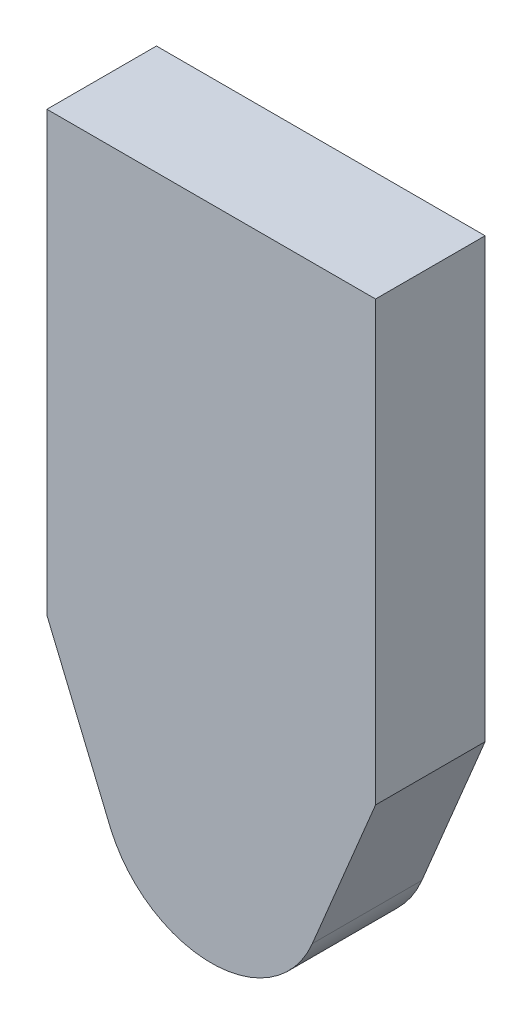
from build123d import *

# Parameters (mm, degrees)
BOSS_EXTRUDE1_DEPTH = 6.35
SKETCH2_W           = 19.05
SKETCH2_H           = 25.4
BOSS_EXTRUDE2_DEPTH = 6.35


with BuildPart() as part:
    # Sketch1 → Boss-Extrude1 (new body)
    with BuildSketch(Plane.XY):
        with BuildLine():
            Line((-9.525, 0), (9.525, 0))
            Line((9.525, 0), (5.861538462, -8.792307692))
            ThreePointArc((5.861538462, -8.792307692), (0, -12.7), (-5.861538462, -8.792307692))
            Line((-5.861538462, -8.792307692), (-9.525, 0))
        make_face()
    extrude(amount=BOSS_EXTRUDE1_DEPTH)

    # Sketch2 → Boss-Extrude2 (add)
    with BuildSketch(Plane.XY.offset(6.35)):
        with Locations((0, 12.7)):
            Rectangle(SKETCH2_W, SKETCH2_H)
    extrude(amount=-BOSS_EXTRUDE2_DEPTH)


solid = part.part
